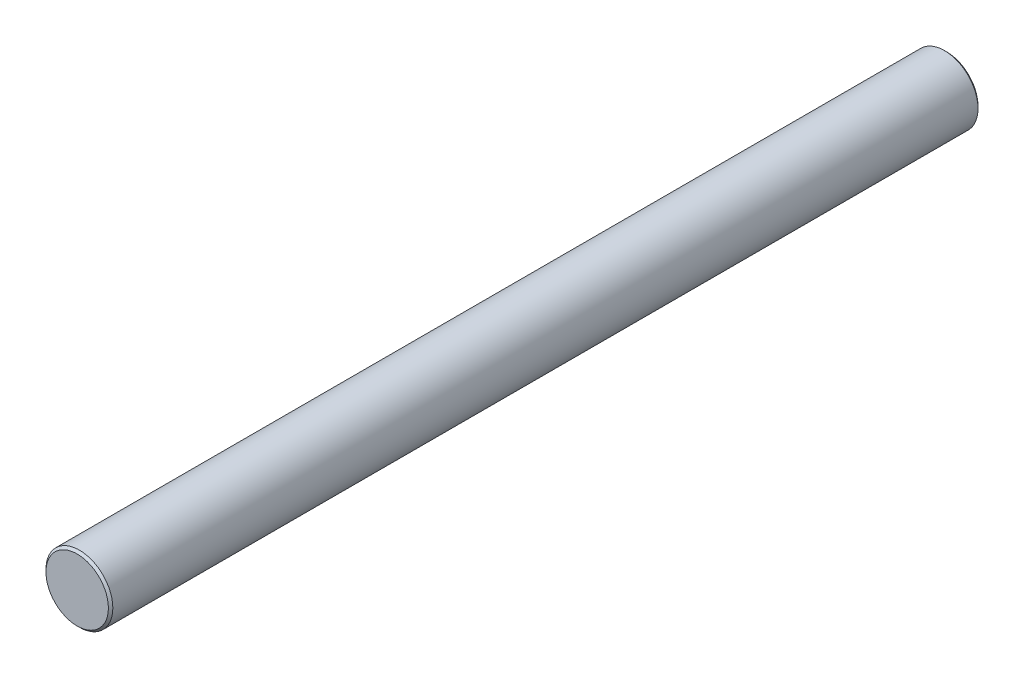
from build123d import *

# Parameters (mm, degrees)
ESQUISSE1_R        = 1.5
BOSS_EXTRU_1_DEPTH = 39
CHANFREIN1_SIZE    = 0.1


with BuildPart() as part:
    # Esquisse1 → Boss.-Extru.1 (new body)
    with BuildSketch(Plane.XY):
        Circle(ESQUISSE1_R)
    extrude(amount=BOSS_EXTRU_1_DEPTH)

    # Chanfrein1
    chanfrein1_edges = [part.edges().sort_by_distance(p)[0] for p in [
        (-1.5, 0, 0),
        (-1.5, 0, 39),
    ]]
    chamfer(chanfrein1_edges, length=CHANFREIN1_SIZE)


solid = part.part
